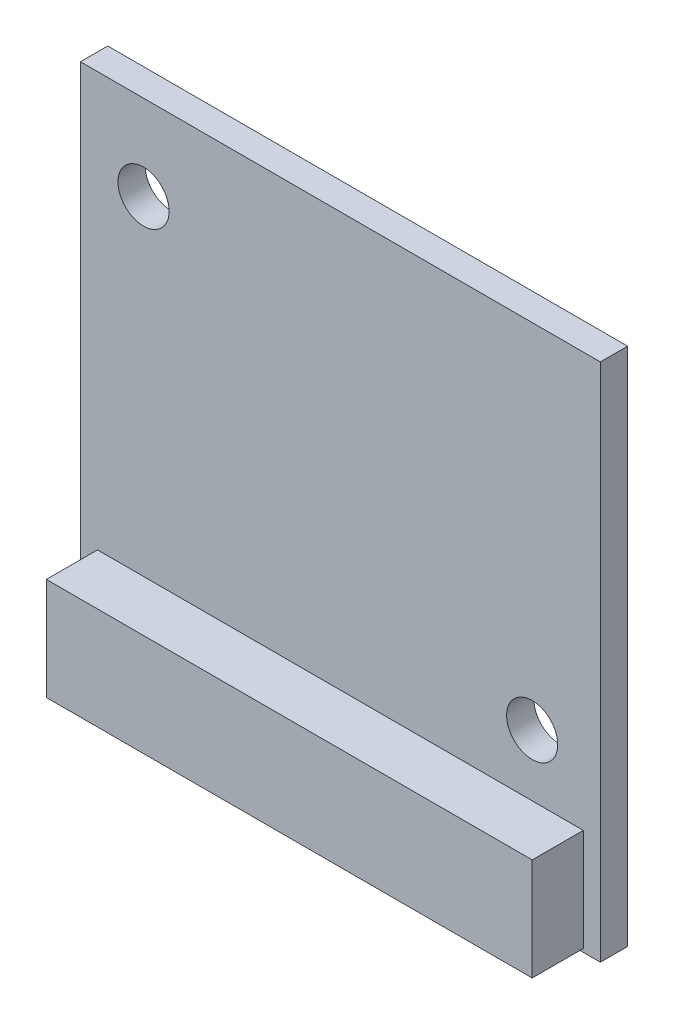
from build123d import *

# Parameters (mm, degrees)
SKETCH1_W             = 30.5
SKETCH1_H             = 30.5
BOSS_EXTRUDE1_DEPTH   = 1.6
F_3_0MM_DOWEL_HOLE1_D = 3
SKETCH4_W             = 28.5
SKETCH4_H             = 6
BOSS_EXTRUDE2_DEPTH   = 3


with BuildPart() as part:
    # Sketch1 → Boss-Extrude1 (new body)
    with BuildSketch(Plane.XY):
        with Locations((15.25, 15.25)):
            Rectangle(SKETCH1_W, SKETCH1_H)
    extrude(amount=BOSS_EXTRUDE1_DEPTH)

    # Ø3.0mm Dowel Hole1 (through all)
    with Locations(Plane.XY.offset(1.6)):
        with Locations((3.7, 25.5), (26.5, 9.8)):
            Hole(F_3_0MM_DOWEL_HOLE1_D / 2)

    # Sketch4 → Boss-Extrude2 (add)
    with BuildSketch(Plane.XY.offset(1.6)):
        with Locations((15.25, 3.2)):
            Rectangle(SKETCH4_W, SKETCH4_H)
    extrude(amount=BOSS_EXTRUDE2_DEPTH)


solid = part.part
